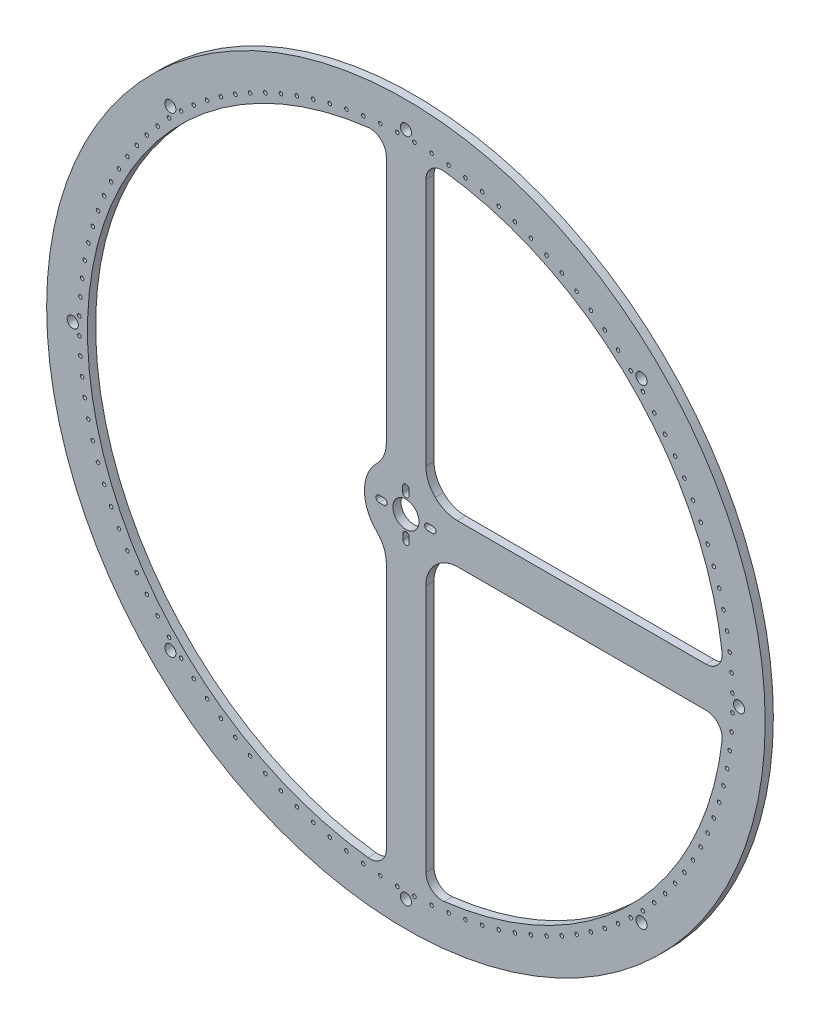
from build123d import *

# Parameters (mm, degrees)
SKETCH1_R               = 139.7
SKETCH1_R_2             = 5.08
SKETCH1_R_3             = 0.6985
SKETCH1_R_4             = 2.159
BOSS_EXTRUDE1_DEPTH     = 3.175
CUT_EXTRUDE1_DEPTH      = 353.710920054
CUT_EXTRUDE1_DEPTH_BACK = 353.710920054
SKETCH2_R               = 2.159


with BuildPart() as part:
    # Sketch1 → Boss-Extrude1 (new body)
    with BuildSketch(Plane.XY):
        with Locations((184.15, 0)):
            Circle(SKETCH1_R)
        with BuildLine():
            ThreePointArc((172.860325846, 11.525507283), (168.016368647, 0), (172.860325846, -11.525507283))
            ThreePointArc((172.860325846, -11.525507283), (175.575295196, -15.52133788), (176.53, -20.256975058))
            Line((176.53, -20.256975058), (176.53, -116.641393703))
            ThreePointArc((176.53, -116.641393703), (174.394699983, -121.39100464), (169.424864865, -122.946333903))
            ThreePointArc((169.424864865, -122.946333903), (92.61631149, -83.39193302), (60.367431735, -3.241360624))
            ThreePointArc((60.367431735, -3.241360624), (60.335608388, -1.620819172), (60.325, 0))
            ThreePointArc((60.325, 0), (91.532586726, 82.186649667), (169.424864865, 122.946333903))
            ThreePointArc((169.424864865, 122.946333903), (174.394699983, 121.39100464), (176.53, 116.641393703))
            Line((176.53, 116.641393703), (176.53, 20.256975058))
            ThreePointArc((176.53, 20.256975058), (175.575295196, 15.52133788), (172.860325846, 11.525507283))
        make_face(mode=Mode.SUBTRACT)
        with BuildLine():
            ThreePointArc((195.522711927, -11.443578289), (195.599368208, -11.366882961), (195.675507283, -11.289674154))
            ThreePointArc((195.675507283, -11.289674154), (199.67133788, -8.574704804), (204.406975058, -7.62))
            Line((204.406975058, -7.62), (300.791393703, -7.62))
            ThreePointArc((300.791393703, -7.62), (305.54100464, -9.755300017), (307.096333903, -14.725135135))
            ThreePointArc((307.096333903, -14.725135135), (271.762261491, -87.502698595), (199.028969414, -122.92781172))
            ThreePointArc((199.028969414, -122.92781172), (194.054217837, -121.376068363), (191.915945342, -116.623821375))
            Line((191.915945342, -116.623821375), (191.915945342, -20.112978481))
            ThreePointArc((191.915945342, -20.112978481), (192.853603627, -15.418107213), (195.522711927, -11.443578289))
        make_face(mode=Mode.SUBTRACT)
        with BuildLine():
            ThreePointArc((195.522838408, 11.44345259), (195.522775167, 11.443515439), (195.522711927, 11.443578289))
            ThreePointArc((195.522711927, 11.443578289), (192.853603627, 15.418107213), (191.915945342, 20.112978481))
            Line((191.915945342, 20.112978481), (191.915945342, 116.623821375))
            ThreePointArc((191.915945342, 116.623821375), (194.054217837, 121.376068363), (199.028969414, 122.92781172))
            ThreePointArc((199.028969414, 122.92781172), (271.660809363, 87.604160116), (307.061878417, 15.010022289))
            ThreePointArc((307.061878417, 15.010022289), (305.513196675, 10.03108399), (300.758705164, 7.890277556))
            Line((300.758705164, 7.890277556), (204.138647641, 7.890277556))
            ThreePointArc((204.138647641, 7.890277556), (199.47878655, 8.813434038), (195.522838408, 11.44345259))
        make_face(mode=Mode.SUBTRACT)
        with BuildLine():
            Line((182.941381345, -9.078964309), (182.941381345, -7.078964309))
            ThreePointArc((182.941381345, -7.078964309), (184.191381345, -5.828964309), (185.441381345, -7.078964309))
            Line((185.441381345, -7.078964309), (185.441381345, -9.078964309))
            ThreePointArc((185.441381345, -9.078964309), (184.191381345, -10.328964309), (182.941381345, -9.078964309))
        make_face(mode=Mode.SUBTRACT)
        with BuildLine():
            Line((173.691383345, 1.25), (175.608616655, 1.25))
            ThreePointArc((175.608616655, 1.25), (176.858616655, 0), (175.608616655, -1.25))
            Line((175.608616655, -1.25), (173.691383345, -1.25))
            ThreePointArc((173.691383345, -1.25), (172.441383345, 0), (173.691383345, 1.25))
        make_face(mode=Mode.SUBTRACT)
        with Locations((184.15, 0)):
            Circle(SKETCH1_R_2, mode=Mode.SUBTRACT)
        with BuildLine():
            Line((185.4, 8.920928665), (185.4, 6.921035691))
            ThreePointArc((185.4, 6.921035691), (184.15, 5.671035691), (182.9, 6.921035691))
            Line((182.9, 6.921035691), (182.9, 8.920928665))
            ThreePointArc((182.9, 8.920928665), (184.15, 10.170928665), (185.4, 8.920928665))
        make_face(mode=Mode.SUBTRACT)
        with BuildLine():
            ThreePointArc((194.608616655, 1.25), (195.858616655, 0), (194.608616655, -1.25))
            Line((194.608616655, -1.25), (192.691383345, -1.25))
            ThreePointArc((192.691383345, -1.25), (191.441383345, 0), (192.691383345, 1.25))
            Line((192.691383345, 1.25), (194.608616655, 1.25))
        make_face(mode=Mode.SUBTRACT)
        with Locations((117.792682281, -108.285300873)):
            Circle(SKETCH1_R_3, mode=Mode.SUBTRACT)
        with Locations((106.837298516, -100.755874217)):
            Circle(SKETCH1_R_3, mode=Mode.SUBTRACT)
        with Locations((112.216407911, -104.664025955)):
            Circle(SKETCH1_R_3, mode=Mode.SUBTRACT)
        with Locations((83.394125783, -77.312701484)):
            Circle(SKETCH1_R_3, mode=Mode.SUBTRACT)
        with Locations((75.864699127, -66.357317719)):
            Circle(SKETCH1_R_3, mode=Mode.SUBTRACT)
        with Locations((79.485974045, -71.933592089)):
            Circle(SKETCH1_R_3, mode=Mode.SUBTRACT)
        with Locations((101.670097862, -96.571557631)):
            Circle(SKETCH1_R_3, mode=Mode.SUBTRACT)
        with Locations((96.728968887, -92.122545119)):
            Circle(SKETCH1_R_3, mode=Mode.SUBTRACT)
        with Locations((92.027454881, -87.421031113)):
            Circle(SKETCH1_R_3, mode=Mode.SUBTRACT)
        with Locations((87.578442369, -82.479902138)):
            Circle(SKETCH1_R_3, mode=Mode.SUBTRACT)
        with Locations((141.756528877, -119.715469369)):
            Circle(SKETCH1_R_3, mode=Mode.SUBTRACT)
        with Locations((135.54920409, -117.332700629)):
            Circle(SKETCH1_R_3, mode=Mode.SUBTRACT)
        with Locations((148.080051223, -121.770106328)):
            Circle(SKETCH1_R_3, mode=Mode.SUBTRACT)
        with Locations((123.550837447, -111.609773308)):
            Circle(SKETCH1_R_3, mode=Mode.SUBTRACT)
        with Locations((129.475090705, -114.628331112)):
            Circle(SKETCH1_R_3, mode=Mode.SUBTRACT)
        with Locations((154.50243879, -123.490979891)):
            Circle(SKETCH1_R_3, mode=Mode.SUBTRACT)
        with Locations((161.006088262, -124.873373261)):
            Circle(SKETCH1_R_3, mode=Mode.SUBTRACT)
        with Locations((167.573173588, -125.913497394)):
            Circle(SKETCH1_R_3, mode=Mode.SUBTRACT)
        with Locations((174.185694843, -126.608501384)):
            Circle(SKETCH1_R_3, mode=Mode.SUBTRACT)
        with Locations((184.15, -129.54)):
            Circle(SKETCH1_R_4, mode=Mode.SUBTRACT)
        with Locations((180.825527565, -126.956480272)):
            Circle(SKETCH1_R_3, mode=Mode.SUBTRACT)
        with Locations((72.540226692, -60.599162553)):
            Circle(SKETCH1_R_3, mode=Mode.SUBTRACT)
        with Locations((69.521668888, -54.674909295)):
            Circle(SKETCH1_R_3, mode=Mode.SUBTRACT)
        with Locations((66.817299371, -48.60079591)):
            Circle(SKETCH1_R_3, mode=Mode.SUBTRACT)
        with Locations((64.434530631, -42.393471123)):
            Circle(SKETCH1_R_3, mode=Mode.SUBTRACT)
        with Locations((62.379893672, -36.069948777)):
            Circle(SKETCH1_R_3, mode=Mode.SUBTRACT)
        with Locations((60.659020109, -29.64756121)):
            Circle(SKETCH1_R_3, mode=Mode.SUBTRACT)
        with Locations((59.276626739, -23.143911738)):
            Circle(SKETCH1_R_3, mode=Mode.SUBTRACT)
        with Locations((58.236502606, -16.576826412)):
            Circle(SKETCH1_R_3, mode=Mode.SUBTRACT)
        with Locations((57.541498616, -9.964305157)):
            Circle(SKETCH1_R_3, mode=Mode.SUBTRACT)
        with Locations((57.193519728, -3.324472435)):
            Circle(SKETCH1_R_3, mode=Mode.SUBTRACT)
        with Locations((250.507317719, 108.285300873)):
            Circle(SKETCH1_R_3, mode=Mode.SUBTRACT)
        with Locations((261.462701484, 100.755874217)):
            Circle(SKETCH1_R_3, mode=Mode.SUBTRACT)
        with Locations((187.474472435, -126.956480272)):
            Circle(SKETCH1_R_3, mode=Mode.SUBTRACT)
        with Locations((194.114305157, -126.608501384)):
            Circle(SKETCH1_R_3, mode=Mode.SUBTRACT)
        with Locations((200.726826412, -125.913497394)):
            Circle(SKETCH1_R_3, mode=Mode.SUBTRACT)
        with Locations((207.293911738, -124.873373261)):
            Circle(SKETCH1_R_3, mode=Mode.SUBTRACT)
        with Locations((213.79756121, -123.490979891)):
            Circle(SKETCH1_R_3, mode=Mode.SUBTRACT)
        with Locations((220.219948777, -121.770106328)):
            Circle(SKETCH1_R_3, mode=Mode.SUBTRACT)
        with Locations((226.543471123, -119.715469369)):
            Circle(SKETCH1_R_3, mode=Mode.SUBTRACT)
        with Locations((232.75079591, -117.332700629)):
            Circle(SKETCH1_R_3, mode=Mode.SUBTRACT)
        with Locations((238.824909295, -114.628331112)):
            Circle(SKETCH1_R_3, mode=Mode.SUBTRACT)
        with Locations((244.749162553, -111.609773308)):
            Circle(SKETCH1_R_3, mode=Mode.SUBTRACT)
        with Locations((250.507317719, -108.285300873)):
            Circle(SKETCH1_R_3, mode=Mode.SUBTRACT)
        with Locations((256.083592089, -104.664025955)):
            Circle(SKETCH1_R_3, mode=Mode.SUBTRACT)
        with Locations((261.462701484, -100.755874217)):
            Circle(SKETCH1_R_3, mode=Mode.SUBTRACT)
        with Locations((266.629902138, -96.571557631)):
            Circle(SKETCH1_R_3, mode=Mode.SUBTRACT)
        with Locations((271.571031113, -92.122545119)):
            Circle(SKETCH1_R_3, mode=Mode.SUBTRACT)
        with Locations((276.272545119, -87.421031113)):
            Circle(SKETCH1_R_3, mode=Mode.SUBTRACT)
        with Locations((280.721557631, -82.479902138)):
            Circle(SKETCH1_R_3, mode=Mode.SUBTRACT)
        with Locations((284.905874217, -77.312701484)):
            Circle(SKETCH1_R_3, mode=Mode.SUBTRACT)
        with Locations((288.814025955, -71.933592089)):
            Circle(SKETCH1_R_3, mode=Mode.SUBTRACT)
        with Locations((292.435300873, -66.357317719)):
            Circle(SKETCH1_R_3, mode=Mode.SUBTRACT)
        with Locations((295.759773308, -60.599162553)):
            Circle(SKETCH1_R_3, mode=Mode.SUBTRACT)
        with Locations((298.778331112, -54.674909295)):
            Circle(SKETCH1_R_3, mode=Mode.SUBTRACT)
        with Locations((301.482700629, -48.60079591)):
            Circle(SKETCH1_R_3, mode=Mode.SUBTRACT)
        with Locations((303.865469369, -42.393471123)):
            Circle(SKETCH1_R_3, mode=Mode.SUBTRACT)
        with Locations((305.920106328, -36.069948777)):
            Circle(SKETCH1_R_3, mode=Mode.SUBTRACT)
        with Locations((307.640979891, -29.64756121)):
            Circle(SKETCH1_R_3, mode=Mode.SUBTRACT)
        with Locations((309.023373261, -23.143911738)):
            Circle(SKETCH1_R_3, mode=Mode.SUBTRACT)
        with Locations((310.063497394, -16.576826412)):
            Circle(SKETCH1_R_3, mode=Mode.SUBTRACT)
        with Locations((310.758501384, -9.964305157)):
            Circle(SKETCH1_R_3, mode=Mode.SUBTRACT)
        with Locations((311.106480272, -3.324472435)):
            Circle(SKETCH1_R_3, mode=Mode.SUBTRACT)
        with Locations((313.69, 0)):
            Circle(SKETCH1_R_4, mode=Mode.SUBTRACT)
        with Locations((54.61, 0)):
            Circle(SKETCH1_R_4, mode=Mode.SUBTRACT)
        with Locations((57.193519728, 3.324472435)):
            Circle(SKETCH1_R_3, mode=Mode.SUBTRACT)
        with Locations((57.541498616, 9.964305157)):
            Circle(SKETCH1_R_3, mode=Mode.SUBTRACT)
        with Locations((58.236502606, 16.576826412)):
            Circle(SKETCH1_R_3, mode=Mode.SUBTRACT)
        with Locations((59.276626739, 23.143911738)):
            Circle(SKETCH1_R_3, mode=Mode.SUBTRACT)
        with Locations((60.659020109, 29.64756121)):
            Circle(SKETCH1_R_3, mode=Mode.SUBTRACT)
        with Locations((62.379893672, 36.069948777)):
            Circle(SKETCH1_R_3, mode=Mode.SUBTRACT)
        with Locations((64.434530631, 42.393471123)):
            Circle(SKETCH1_R_3, mode=Mode.SUBTRACT)
        with Locations((66.817299371, 48.60079591)):
            Circle(SKETCH1_R_3, mode=Mode.SUBTRACT)
        with Locations((69.521668888, 54.674909295)):
            Circle(SKETCH1_R_3, mode=Mode.SUBTRACT)
        with Locations((72.540226692, 60.599162553)):
            Circle(SKETCH1_R_3, mode=Mode.SUBTRACT)
        with Locations((75.864699127, 66.357317719)):
            Circle(SKETCH1_R_3, mode=Mode.SUBTRACT)
        with Locations((79.485974045, 71.933592089)):
            Circle(SKETCH1_R_3, mode=Mode.SUBTRACT)
        with Locations((83.394125783, 77.312701484)):
            Circle(SKETCH1_R_3, mode=Mode.SUBTRACT)
        with Locations((87.578442369, 82.479902138)):
            Circle(SKETCH1_R_3, mode=Mode.SUBTRACT)
        with Locations((92.027454881, 87.421031113)):
            Circle(SKETCH1_R_3, mode=Mode.SUBTRACT)
        with Locations((96.728968887, 92.122545119)):
            Circle(SKETCH1_R_3, mode=Mode.SUBTRACT)
        with Locations((101.670097862, 96.571557631)):
            Circle(SKETCH1_R_3, mode=Mode.SUBTRACT)
        with Locations((106.837298516, 100.755874217)):
            Circle(SKETCH1_R_3, mode=Mode.SUBTRACT)
        with Locations((112.216407911, 104.664025955)):
            Circle(SKETCH1_R_3, mode=Mode.SUBTRACT)
        with Locations((117.792682281, 108.285300873)):
            Circle(SKETCH1_R_3, mode=Mode.SUBTRACT)
        with Locations((123.550837447, 111.609773308)):
            Circle(SKETCH1_R_3, mode=Mode.SUBTRACT)
        with Locations((129.475090705, 114.628331112)):
            Circle(SKETCH1_R_3, mode=Mode.SUBTRACT)
        with Locations((135.54920409, 117.332700629)):
            Circle(SKETCH1_R_3, mode=Mode.SUBTRACT)
        with Locations((141.756528877, 119.715469369)):
            Circle(SKETCH1_R_3, mode=Mode.SUBTRACT)
        with Locations((148.080051223, 121.770106328)):
            Circle(SKETCH1_R_3, mode=Mode.SUBTRACT)
        with Locations((154.50243879, 123.490979891)):
            Circle(SKETCH1_R_3, mode=Mode.SUBTRACT)
        with Locations((161.006088262, 124.873373261)):
            Circle(SKETCH1_R_3, mode=Mode.SUBTRACT)
        with Locations((167.573173588, 125.913497394)):
            Circle(SKETCH1_R_3, mode=Mode.SUBTRACT)
        with Locations((174.185694843, 126.608501384)):
            Circle(SKETCH1_R_3, mode=Mode.SUBTRACT)
        with Locations((180.825527565, 126.956480272)):
            Circle(SKETCH1_R_3, mode=Mode.SUBTRACT)
        with Locations((311.106480272, 3.324472435)):
            Circle(SKETCH1_R_3, mode=Mode.SUBTRACT)
        with Locations((310.758501384, 9.964305157)):
            Circle(SKETCH1_R_3, mode=Mode.SUBTRACT)
        with Locations((310.063497394, 16.576826412)):
            Circle(SKETCH1_R_3, mode=Mode.SUBTRACT)
        with Locations((309.023373261, 23.143911738)):
            Circle(SKETCH1_R_3, mode=Mode.SUBTRACT)
        with Locations((307.640979891, 29.64756121)):
            Circle(SKETCH1_R_3, mode=Mode.SUBTRACT)
        with Locations((305.920106328, 36.069948777)):
            Circle(SKETCH1_R_3, mode=Mode.SUBTRACT)
        with Locations((303.865469369, 42.393471123)):
            Circle(SKETCH1_R_3, mode=Mode.SUBTRACT)
        with Locations((301.482700629, 48.60079591)):
            Circle(SKETCH1_R_3, mode=Mode.SUBTRACT)
        with Locations((298.778331112, 54.674909295)):
            Circle(SKETCH1_R_3, mode=Mode.SUBTRACT)
        with Locations((295.759773308, 60.599162553)):
            Circle(SKETCH1_R_3, mode=Mode.SUBTRACT)
        with Locations((187.474472435, 126.956480272)):
            Circle(SKETCH1_R_3, mode=Mode.SUBTRACT)
        with Locations((184.15, 129.54)):
            Circle(SKETCH1_R_4, mode=Mode.SUBTRACT)
        with Locations((194.114305157, 126.608501384)):
            Circle(SKETCH1_R_3, mode=Mode.SUBTRACT)
        with Locations((200.726826412, 125.913497394)):
            Circle(SKETCH1_R_3, mode=Mode.SUBTRACT)
        with Locations((207.293911738, 124.873373261)):
            Circle(SKETCH1_R_3, mode=Mode.SUBTRACT)
        with Locations((213.79756121, 123.490979891)):
            Circle(SKETCH1_R_3, mode=Mode.SUBTRACT)
        with Locations((238.824909295, 114.628331112)):
            Circle(SKETCH1_R_3, mode=Mode.SUBTRACT)
        with Locations((244.749162553, 111.609773308)):
            Circle(SKETCH1_R_3, mode=Mode.SUBTRACT)
        with Locations((220.219948777, 121.770106328)):
            Circle(SKETCH1_R_3, mode=Mode.SUBTRACT)
        with Locations((232.75079591, 117.332700629)):
            Circle(SKETCH1_R_3, mode=Mode.SUBTRACT)
        with Locations((226.543471123, 119.715469369)):
            Circle(SKETCH1_R_3, mode=Mode.SUBTRACT)
        with Locations((280.721557631, 82.479902138)):
            Circle(SKETCH1_R_3, mode=Mode.SUBTRACT)
        with Locations((276.272545119, 87.421031113)):
            Circle(SKETCH1_R_3, mode=Mode.SUBTRACT)
        with Locations((271.571031113, 92.122545119)):
            Circle(SKETCH1_R_3, mode=Mode.SUBTRACT)
        with Locations((266.629902138, 96.571557631)):
            Circle(SKETCH1_R_3, mode=Mode.SUBTRACT)
        with Locations((288.814025955, 71.933592089)):
            Circle(SKETCH1_R_3, mode=Mode.SUBTRACT)
        with Locations((292.435300873, 66.357317719)):
            Circle(SKETCH1_R_3, mode=Mode.SUBTRACT)
        with Locations((284.905874217, 77.312701484)):
            Circle(SKETCH1_R_3, mode=Mode.SUBTRACT)
        with Locations((256.083592089, 104.664025955)):
            Circle(SKETCH1_R_3, mode=Mode.SUBTRACT)
    extrude(amount=BOSS_EXTRUDE1_DEPTH)

    # Sketch2 → Cut-Extrude1 (cut, two sides: drawn at the far end of the back side and taken through both)
    with BuildSketch(Plane(origin=(0, 0, 0), x_dir=(-1, 0, 0), z_dir=(0, 0, -1)).offset(-CUT_EXTRUDE1_DEPTH_BACK)):
        with Locations((-92.551387565, -91.598612435)):
            Circle(SKETCH2_R)
        with Locations((-275.748612435, -91.598612435)):
            Circle(SKETCH2_R)
        with Locations((-275.748612435, 91.598612435)):
            Circle(SKETCH2_R)
        with Locations((-92.551387565, 91.598612435)):
            Circle(SKETCH2_R)
    extrude(amount=CUT_EXTRUDE1_DEPTH + CUT_EXTRUDE1_DEPTH_BACK, mode=Mode.SUBTRACT)


solid = part.part
